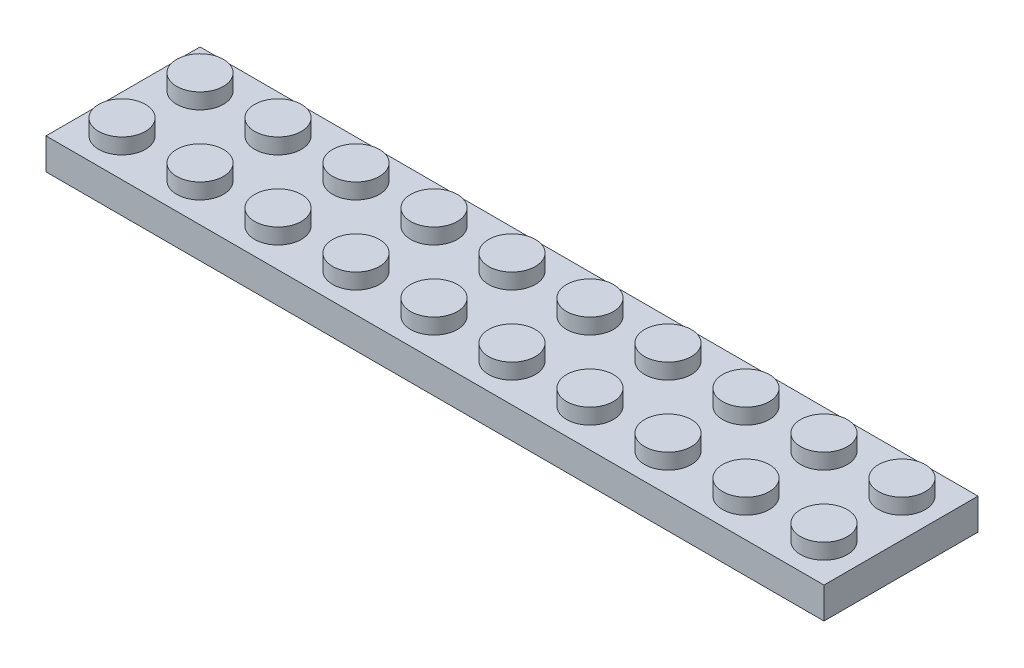
from build123d import *

# Parameters (mm, degrees)
SKETCH1_W            = 79.8
SKETCH1_H            = 3.2
BOSS_EXTRUDE1_DEPTH  = 15.8
SKETCH2_R            = 2.4
BOSS_EXTRUDE2_DEPTH  = 1.6
LPATTERN1_COUNT      = 2
LPATTERN1_PITCH      = 8
LPATTERN1_COUNT_DIR2 = 10
LPATTERN1_PITCH_DIR2 = 8
SHELL1_T             = -1.2
SKETCH3_R            = 3.25
SKETCH3_R_2          = 2.4
BOSS_EXTRUDE3_DEPTH  = 1.8
LPATTERN2_COUNT      = 9
LPATTERN2_PITCH      = 8


with BuildPart() as part:
    # Sketch1 → Boss-Extrude1 (new body)
    with BuildSketch(Plane.XY):
        with Locations((39.9, 1.6)):
            Rectangle(SKETCH1_W, SKETCH1_H)
    extrude(amount=-BOSS_EXTRUDE1_DEPTH)

    # Sketch2 → Boss-Extrude2 (add)
    with BuildSketch(Plane(origin=(0, 3.2, 0), x_dir=(1, 0, 0), z_dir=(0, 1, 0))):
        with Locations(Location((3.9, 3.9, 0), (0, 0, 270))):
            Circle(SKETCH2_R)
    boss_extrude2 = extrude(amount=BOSS_EXTRUDE2_DEPTH)

    # LPattern1: Boss-Extrude2 2 × 10
    with Locations(*[(j * LPATTERN1_PITCH_DIR2, 0, -i * LPATTERN1_PITCH) for i in range(LPATTERN1_COUNT) for j in range(LPATTERN1_COUNT_DIR2) if (i, j) != (0, 0)]):
        add(boss_extrude2)

    # Shell1
    shell1_openings = [part.faces().sort_by_distance(p)[0] for p in [
        (39.9, 0, -7.9),
    ]]
    offset(amount=SHELL1_T, openings=shell1_openings, kind=Kind.INTERSECTION)

    # Sketch3 → Boss-Extrude3 (add)
    with BuildSketch(Plane.XZ.offset(-2)):
        with Locations(Location((7.9, -7.9, 0), (0, 0, 90))):
            Circle(SKETCH3_R)
        with Locations(Location((7.9, -7.9, 0), (0, 0, 270))):
            Circle(SKETCH3_R_2, mode=Mode.SUBTRACT)
    boss_extrude3 = extrude(amount=BOSS_EXTRUDE3_DEPTH)

    # LPattern2: Boss-Extrude3 ×9
    with Locations(*[(i * LPATTERN2_PITCH, 0, 0) for i in range(1, LPATTERN2_COUNT)]):
        add(boss_extrude3)


solid = part.part
